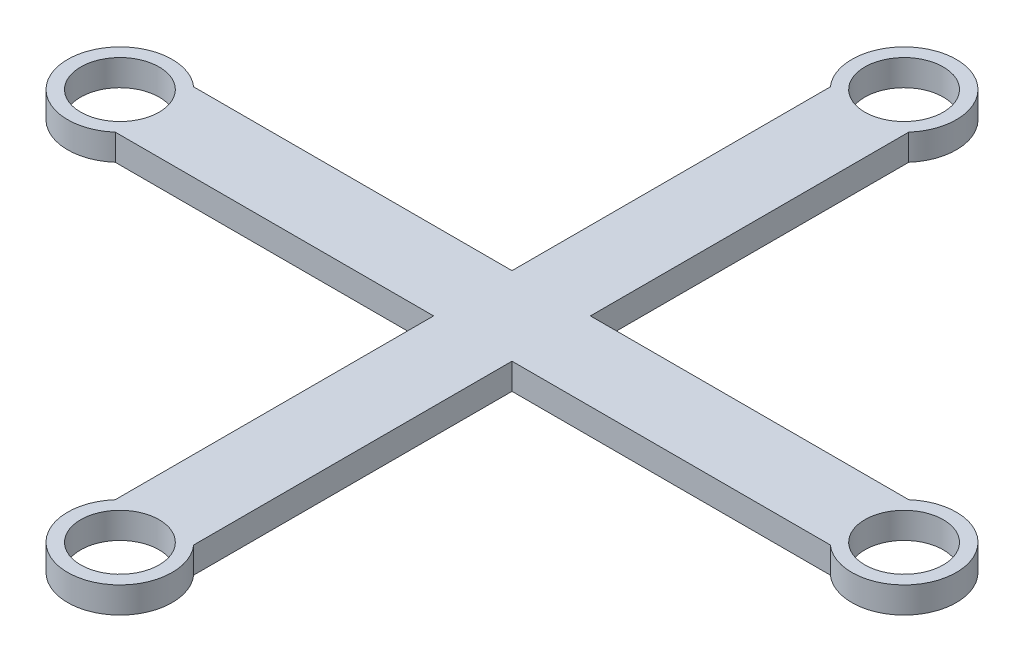
from build123d import *

# Parameters (mm, degrees)
SKETCH1_R           = 15
SKETCH1_W           = 30
SKETCH1_H           = 30
BOSS_EXTRUDE2_DEPTH = 10


with BuildPart() as part:
    # Sketch1 → Boss-Extrude2 (new body)
    # profile 1 of 5: a face of its own
    with BuildSketch(Plane(origin=(0, 0, 0), x_dir=(1, 0, 0), z_dir=(0, 1, 0))):
        with BuildLine():
            Line((15, -15), (-15, -15))
            Line((-15, -15), (-15, -136.771243445))
            ThreePointArc((-15, -136.771243445), (0, -170), (15, -136.771243445))
            Line((15, -136.771243445), (15, -15))
        make_face()
        with Locations(Location((0, -150, 0), (0, 0, 270))):
            Circle(SKETCH1_R, mode=Mode.SUBTRACT)
    # profile 2 of 5: a face of its own
    with BuildSketch(Plane(origin=(0, 0, 0), x_dir=(1, 0, 0), z_dir=(0, 1, 0))):
        Rectangle(SKETCH1_W, SKETCH1_H)
    # profile 3 of 5: a face of its own
    with BuildSketch(Plane(origin=(0, 0, 0), x_dir=(1, 0, 0), z_dir=(0, 1, 0))):
        with BuildLine():
            Line((-15, 136.771243445), (-15, 15))
            Line((-15, 15), (15, 15))
            Line((15, 15), (15, 136.771243445))
            ThreePointArc((15, 136.771243445), (0, 170), (-15, 136.771243445))
        make_face()
        with Locations(Location((0, 150, 0), (0, 0, 270))):
            Circle(SKETCH1_R, mode=Mode.SUBTRACT)
    # profile 4 of 5: a face of its own
    with BuildSketch(Plane(origin=(0, 0, 0), x_dir=(1, 0, 0), z_dir=(0, 1, 0))):
        with BuildLine():
            Line((-15, 15), (-136.771243445, 15))
            ThreePointArc((-136.771243445, 15), (-170, 0), (-136.771243445, -15))
            Line((-136.771243445, -15), (-15, -15))
            Line((-15, -15), (-15, 15))
        make_face()
        with Locations(Location((-150, 0, 0), (0, 0, 270))):
            Circle(SKETCH1_R, mode=Mode.SUBTRACT)
    # profile 5 of 5: a face of its own
    with BuildSketch(Plane(origin=(0, 0, 0), x_dir=(1, 0, 0), z_dir=(0, 1, 0))):
        with BuildLine():
            Line((136.771243445, 15), (15, 15))
            Line((15, 15), (15, -15))
            Line((15, -15), (136.771243445, -15))
            ThreePointArc((136.771243445, -15), (170, 0), (136.771243445, 15))
        make_face()
        with Locations(Location((150, 0, 0), (0, 0, 270))):
            Circle(SKETCH1_R, mode=Mode.SUBTRACT)
    extrude(amount=BOSS_EXTRUDE2_DEPTH)


solid = part.part
